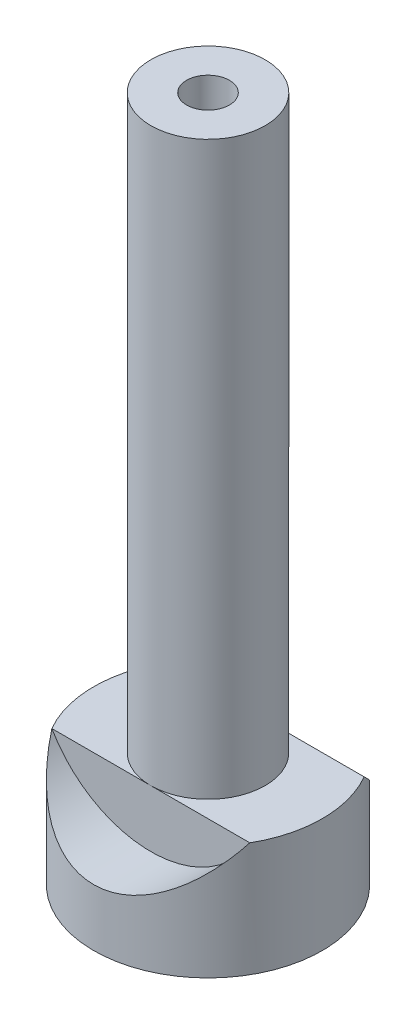
from build123d import *

# Parameters (mm, degrees)
SKETCH1_R           = 6.35
BOSS_EXTRUDE1_DEPTH = 63.5
SKETCH5_R           = 12.7
BOSS_EXTRUDE2_DEPTH = 12.7
SKETCH10_R          = 12.7
CUT_EXTRUDE5_DEPTH  = 68.501425911
SKETCH12_R          = 12.7
CUT_EXTRUDE6_DEPTH  = 68.501425911
SKETCH13_R          = 2.38125
CUT_EXTRUDE7_DEPTH  = 50.8


with BuildPart() as part:
    # Sketch1 → Boss-Extrude1 (new body)
    with BuildSketch(Plane(origin=(0, 0, 0), x_dir=(1, 0, 0), z_dir=(0, 1, 0))):
        with Locations(Location((0, 0, 0), (0, 0, 270))):
            Circle(SKETCH1_R)
    extrude(amount=BOSS_EXTRUDE1_DEPTH)

    # Sketch5 → Boss-Extrude2 (add)
    with BuildSketch(Plane.XZ):
        with Locations(Location((0, 0, 0), (0, 0, 270))):
            Circle(SKETCH5_R)
    extrude(amount=BOSS_EXTRUDE2_DEPTH)

    # Sketch10 → Cut-Extrude5 (cut, through all)
    with BuildSketch(Plane.XY.offset(6.35)):
        with Locations((0, 6.35)):
            Circle(SKETCH10_R)
    extrude(amount=CUT_EXTRUDE5_DEPTH, mode=Mode.SUBTRACT)

    # Sketch12 → Cut-Extrude6 (cut, through all)
    with BuildSketch(Plane(origin=(0, 0, -6.35), x_dir=(-1, 0, 0), z_dir=(0, 0, -1))):
        with Locations((0, 6.35)):
            Circle(SKETCH12_R)
    extrude(amount=CUT_EXTRUDE6_DEPTH, mode=Mode.SUBTRACT)

    # Sketch13 → Cut-Extrude7 (cut)
    with BuildSketch(Plane(origin=(0, 63.5, 0), x_dir=(1, 0, 0), z_dir=(0, 1, 0))):
        with Locations(Location((0, 0, 0), (0, 0, 270))):
            Circle(SKETCH13_R)
    extrude(amount=-CUT_EXTRUDE7_DEPTH, mode=Mode.SUBTRACT)


solid = part.part
